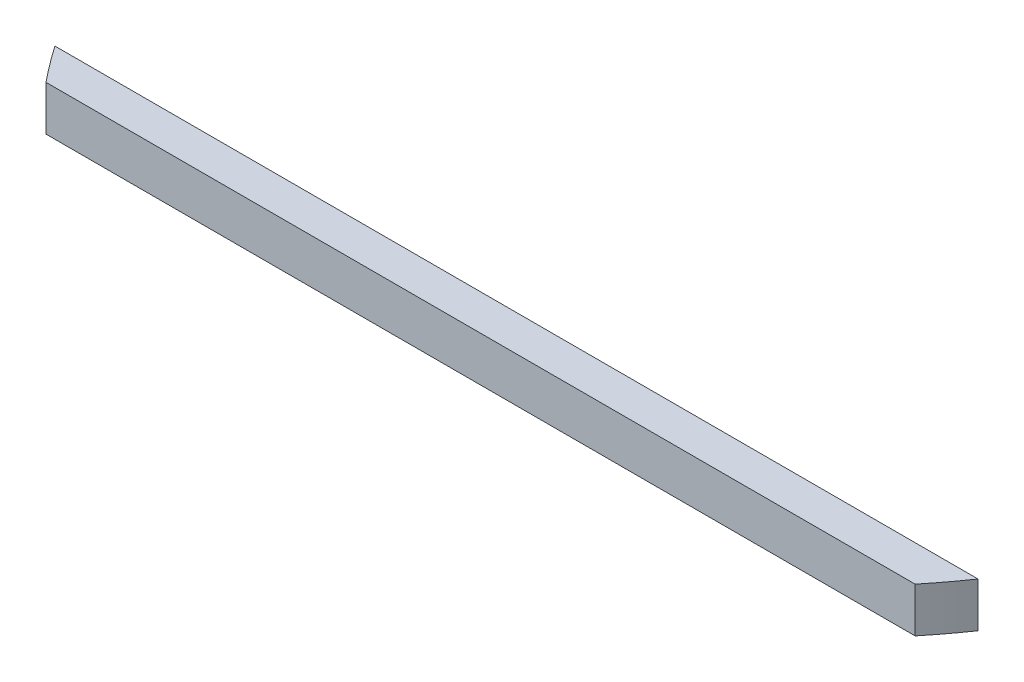
from build123d import *

# Parameters (mm, degrees)
BOSS_EXTRUDE1_DEPTH = 5


with BuildPart() as part:
    # Sketch1 → Boss-Extrude1 (new body)
    with BuildSketch(Plane(origin=(0, 0, 0), x_dir=(1, 0, 0), z_dir=(0, 1, 0))):
        with BuildLine():
            Line((-48.435524153, -39.5), (48.435524153, -39.5))
            ThreePointArc((48.435524153, -39.5), (49.977438468, -37.530063205), (51.439284598, -35.5))
            Line((51.439284598, -35.5), (-51.439284598, -35.5))
            ThreePointArc((-51.439284598, -35.5), (-49.977438468, -37.530063205), (-48.435524153, -39.5))
        make_face()
    extrude(amount=BOSS_EXTRUDE1_DEPTH)


solid = part.part
